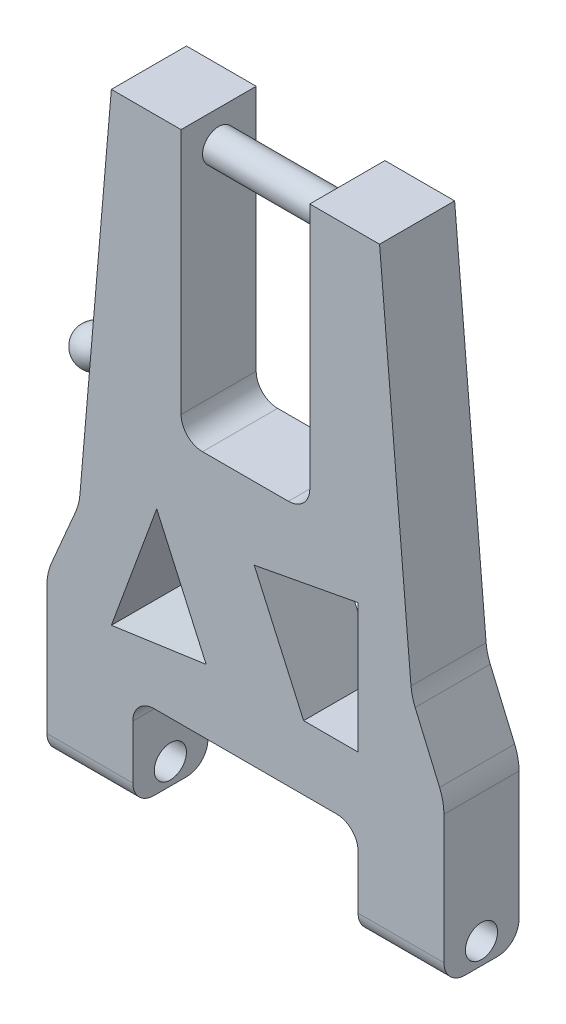
from build123d import *

# Parameters (mm, degrees)
EXTRUDE_1_DEPTH     = 7
SKETCH_2_R          = 1.5
CUT_EXTRUDE_1_DEPTH = 50
SKETCH_5_R          = 2
EXTRUDE_2_DEPTH     = 2
FILLET_2_R          = 2
SKETCH_3_R          = 1.5
EXTRUDE_3_DEPTH     = 12


with BuildPart() as part:
    # 草图1 → 凸台-拉伸1 (new body)
    with BuildSketch(Plane.XY):
        with BuildLine():
            Line((0, 13.97371149), (0, 0))
            Line((0, 0), (8, 0))
            Line((8, 0), (8, 7))
            ThreePointArc((8, 7), (8.585786438, 8.414213562), (10, 9))
            Line((10, 9), (27, 9))
            ThreePointArc((27, 9), (28.414213562, 8.414213562), (29, 7))
            Line((29, 7), (29, 0))
            Line((29, 0), (37, 0))
            Line((37, 0), (37, 13.97371149))
            ThreePointArc((37, 13.97371149), (36.897888614, 14.979040852), (36.59572515, 15.943307983))
            Line((36.59572515, 15.943307983), (34.317232535, 21.259790752))
            ThreePointArc((34.317232535, 21.259790752), (34.062511941, 22.01564259), (33.93122444, 22.802381539))
            Line((33.93122444, 22.802381539), (31, 57))
            Line((31, 57), (24.5, 57))
            Line((24.5, 57), (24.5, 34))
            ThreePointArc((24.5, 34), (23.914213562, 32.585786438), (22.5, 32))
            Line((22.5, 32), (18.5, 32))
            Line((18.5, 32), (14.5, 32))
            ThreePointArc((14.5, 32), (13.085786438, 32.585786438), (12.5, 34))
            Line((12.5, 34), (12.5, 57))
            Line((12.5, 57), (6, 57))
            Line((6, 57), (3.06877556, 22.802381539))
            ThreePointArc((3.06877556, 22.802381539), (2.937488059, 22.01564259), (2.682767465, 21.259790752))
            Line((2.682767465, 21.259790752), (0.40427485, 15.943307983))
            ThreePointArc((0.40427485, 15.943307983), (0.102111386, 14.979040852), (0, 13.97371149))
        make_face()
        Polygon((6, 13.736227722), (10.229385492, 25.248189223), (14.834170093, 15), align=None, mode=Mode.SUBTRACT)
        Polygon((23.922560752, 15), (19.317776151, 25.248189223), (29, 27.065867355), (29, 15), align=None, mode=Mode.SUBTRACT)
    extrude(amount=EXTRUDE_1_DEPTH)

    # 草图2 → 切除-拉伸1 (cut, symmetric)
    with BuildSketch(Plane(origin=(8, 0, 0), x_dir=(0, 0, -1), z_dir=(1, 0, 0))):
        with Locations(Location((-3.5, 2, 0), (0, 0, 180))):
            Circle(SKETCH_2_R)
    extrude(amount=CUT_EXTRUDE_1_DEPTH, both=True, mode=Mode.SUBTRACT)

    # 草图5 → 凸台-拉伸2 (add)
    with BuildSketch(Plane.ZY.offset(-3)):
        with Locations((3.5, 32)):
            Circle(SKETCH_5_R)
    extrude(amount=-EXTRUDE_2_DEPTH)

    # 草图6 → 旋转1 (revolve)
    with BuildSketch(Plane(origin=(0, 0, 3.5), x_dir=(-1, 0, 0), z_dir=(0, 0, -1)), mode=Mode.PRIVATE) as revolve_1_sk:
        with BuildLine():
            Line((-3, 32), (-3, 30))
            Line((-3, 30), (-2.237436867, 30.762563133))
            ThreePointArc((-2.237436867, 30.762563133), (-0.330303993, 30.383210818), (0.75, 32))
            Line((0.75, 32), (-1, 32))
            Line((-1, 32), (-3, 32))
        make_face()
    revolve(revolve_1_sk.sketch.rotate(Axis((3, 32, 3.5), (-1, 0, 0)), 270), axis=Axis((3, 32, 3.5), (-1, 0, 0)))

    # 圆角2
    fillet_2_edges = [part.edges().sort_by_distance(p)[0] for p in [
        (33, 0, 0),
        (4, 0, 0),
        (4, 0, 7),
        (33, 0, 7),
    ]]
    fillet(fillet_2_edges, radius=FILLET_2_R)

    # 草图3 → 凸台-拉伸3 (add)
    with BuildSketch(Plane(origin=(12.5, 0, 0), x_dir=(0, 0, -1), z_dir=(1, 0, 0))):
        with Locations(Location((-3.5, 54, 0), (0, 0, 90))):
            Circle(SKETCH_3_R)
    extrude(amount=EXTRUDE_3_DEPTH)


solid = part.part
